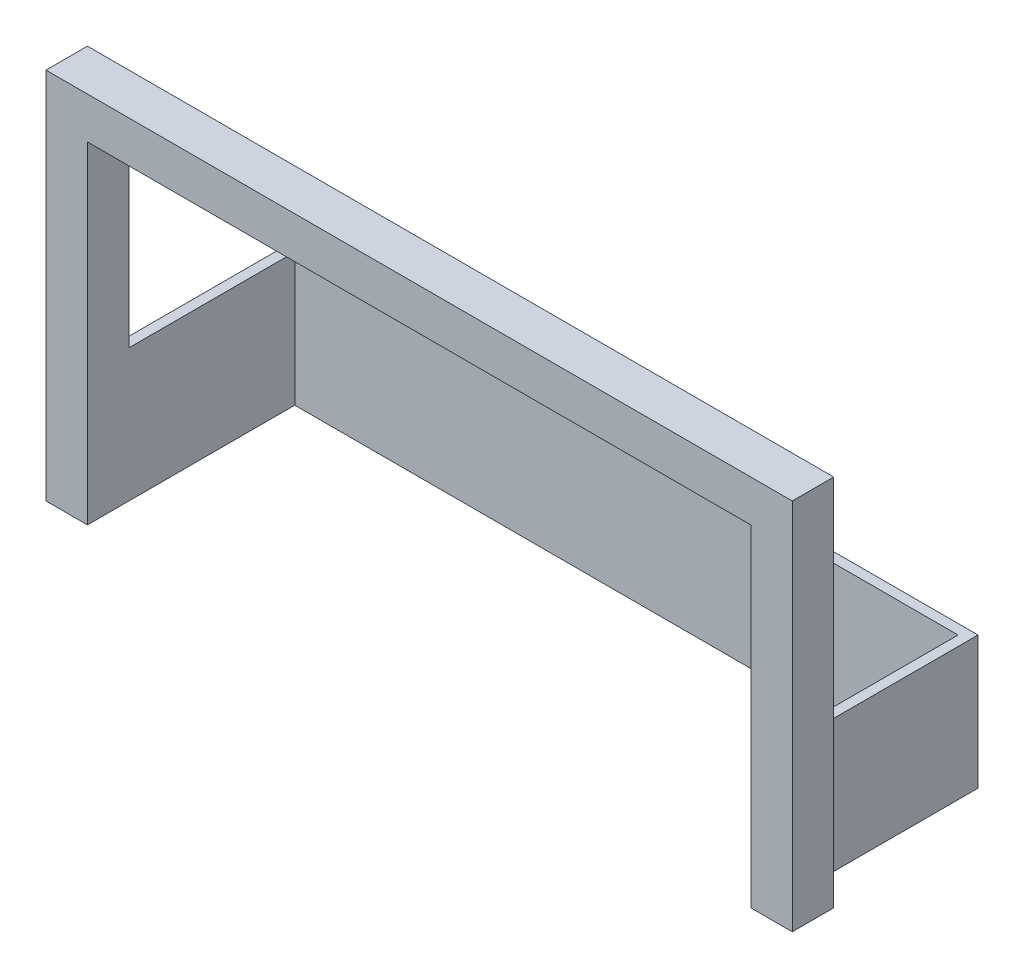
from build123d import *

# Parameters (mm, degrees)
EXTRUDE_1_DEPTH   = 125
EXTRUDE_1_2_DEPTH = 400


with BuildPart() as part:
    # 草图1 → Extrude 1 (new body)
    with BuildSketch(Plane.XY):
        Polygon((-1125, 1125), (-1125, 0), (-1000, 0), (-1000, 1000), (1000, 1000), (1000, 0), (1125, 0), (1125, 1125), align=None)
    extrude(amount=-EXTRUDE_1_DEPTH)

    # 草图2 → Extrude 1 2 (add)
    with BuildSketch(Plane.XZ):
        Polygon((-1000, -125), (-1000, -625), (1000, -625), (1000, -125), (1030, -125), (1030, -655), (-1030, -655), (-1030, -125), align=None)
    extrude(amount=-EXTRUDE_1_2_DEPTH)


solid = part.part
